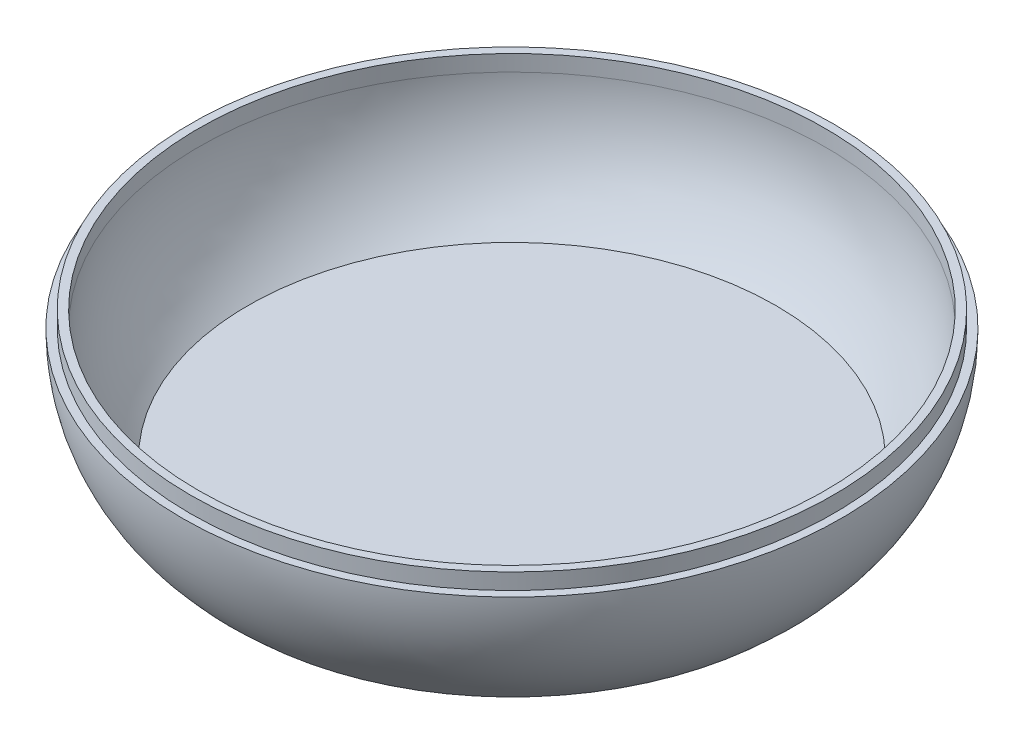
from build123d import *

# Parameters (mm, degrees)
SHELL2_T            = -2
SKETCH6_R           = 40
SKETCH6_R_2         = 39
BOSS_EXTRUDE1_DEPTH = 2


with BuildPart() as part:
    # Sketch1 (on Front Plane) → Revolve2 (revolve)
    with BuildSketch(Plane.XY):
        with BuildLine():
            Line((0, 0), (41, 0))
            Line((41, 0), (41, -16))
            Line((41, -16), (7.398529491, -16))
            ThreePointArc((7.398529491, -16), (1.939164752, -8.813884482), (0, 0))
        make_face()
    revolve(axis=Axis((41, 0, 0), (0, -1, 0)))

    # Shell2
    shell2_openings = [part.faces().sort_by_distance(p)[0] for p in [
        (41, 0, 0),
    ]]
    offset(amount=SHELL2_T, openings=shell2_openings, kind=Kind.INTERSECTION)

    # Sketch6 → Boss-Extrude1 (add)
    with BuildSketch(Plane(origin=(0, 0, 0), x_dir=(1, 0, 0), z_dir=(0, 1, 0))):
        with Locations((41, 0)):
            Circle(SKETCH6_R)
        with Locations((41, 0)):
            Circle(SKETCH6_R_2, mode=Mode.SUBTRACT)
    extrude(amount=BOSS_EXTRUDE1_DEPTH)


solid = part.part
